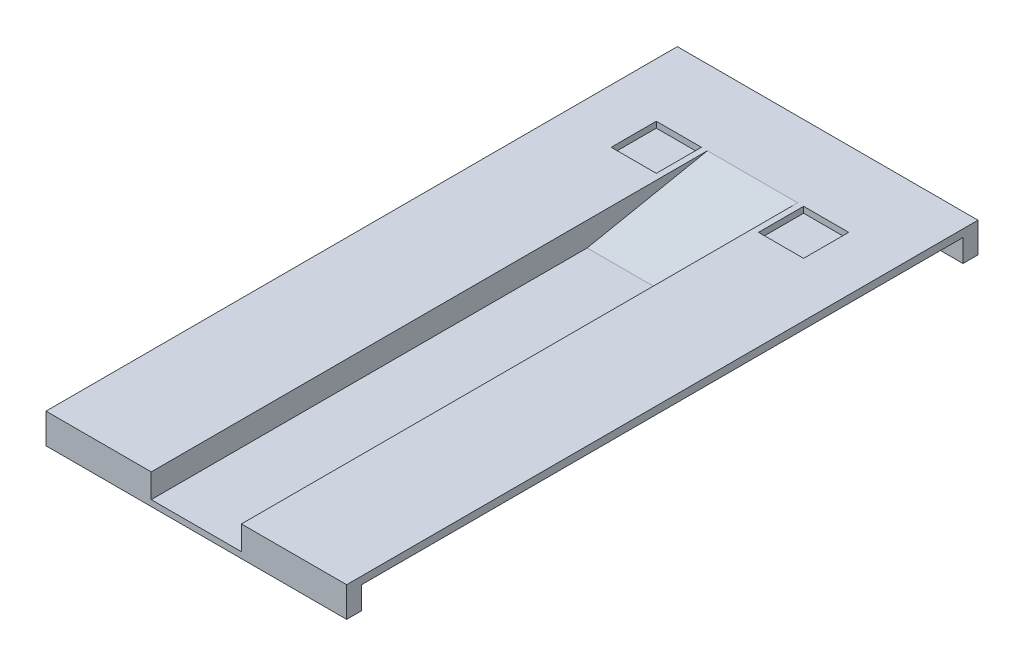
from build123d import *

# Parameters (mm, degrees)
SKETCH1_W           = 100
SKETCH1_H           = 210
BOSS_EXTRUDE1_DEPTH = 10
SKETCH2_W           = 30
SKETCH2_H           = 185
CUT_EXTRUDE2_DEPTH  = 8
BOSS_EXTRUDE3_DEPTH = 30
SKETCH4_W           = 200
SKETCH4_H           = 7.5
CUT_EXTRUDE3_DEPTH  = 10
SKETCH5_W           = 200
SKETCH5_H           = 7.5
CUT_EXTRUDE4_DEPTH  = 10
SKETCH6_W           = 15
SKETCH6_H           = 15
CUT_EXTRUDE5_DEPTH  = 2


with BuildPart() as part:
    # Sketch1 → Boss-Extrude1 (new body)
    with BuildSketch(Plane(origin=(0, 0, 0), x_dir=(1, 0, 0), z_dir=(0, 1, 0))):
        with Locations((50, -105)):
            Rectangle(SKETCH1_W, SKETCH1_H)
    extrude(amount=BOSS_EXTRUDE1_DEPTH)

    # Sketch2 → Cut-Extrude2 (cut)
    with BuildSketch(Plane(origin=(0, 10, 0), x_dir=(1, 0, 0), z_dir=(0, 1, 0))):
        with Locations((50, -117.5)):
            Rectangle(SKETCH2_W, SKETCH2_H)
    extrude(amount=-CUT_EXTRUDE2_DEPTH, mode=Mode.SUBTRACT)

    # Sketch3 → Boss-Extrude3 (add)
    with BuildSketch(Plane.ZY.offset(-65)):
        Polygon((25, 2), (65, 2), (25, 10), align=None)
    extrude(amount=BOSS_EXTRUDE3_DEPTH)

    # Sketch4 → Cut-Extrude3 (cut)
    with BuildSketch(Plane(origin=(100, 0, 0), x_dir=(0, 0, -1), z_dir=(1, 0, 0))):
        with Locations((-105, 3.75)):
            Rectangle(SKETCH4_W, SKETCH4_H)
    extrude(amount=-CUT_EXTRUDE3_DEPTH, mode=Mode.SUBTRACT)

    # Sketch5 → Cut-Extrude4 (cut)
    with BuildSketch(Plane.ZY):
        with Locations((105, 3.75)):
            Rectangle(SKETCH5_W, SKETCH5_H)
    extrude(amount=-CUT_EXTRUDE4_DEPTH, mode=Mode.SUBTRACT)

    # Sketch6 → Cut-Extrude5 (cut)
    with BuildSketch(Plane(origin=(0, 10, 0), x_dir=(1, 0, 0), z_dir=(0, 1, 0))):
        with Locations((25.5, -32.5)):
            Rectangle(SKETCH6_W, SKETCH6_H)
        with Locations((74.5, -32.5)):
            Rectangle(SKETCH6_W, SKETCH6_H)
    extrude(amount=-CUT_EXTRUDE5_DEPTH, mode=Mode.SUBTRACT)


solid = part.part
